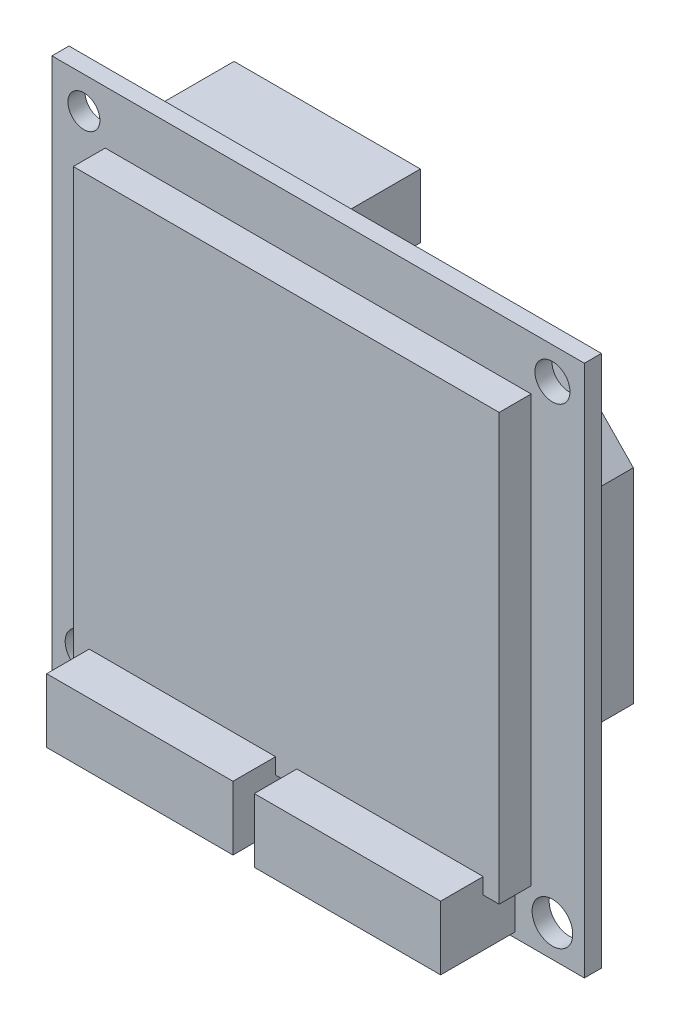
from build123d import *

# Parameters (mm, degrees)
SKETCH1_W      = 50
SKETCH1_H      = 50
SKETCH1_R      = 1.5
SKETCH1_R_2    = 1.646935024
SKETCH1_R_3    = 1.908192471
SKETCH1_R_4    = 1.759080553
EXTRUDE2_DEPTH = 0.8
EXTRUDE3_DEPTH = 3
EXTRUDE4_DEPTH = 8
SKETCH4_W      = 17.5
SKETCH4_H      = 6
EXTRUDE6_DEPTH = 7
SKETCH5_W      = 17.5
SKETCH5_H      = 6
EXTRUDE7_DEPTH = 7


with BuildPart() as part:
    # Sketch1 → Extrude2 (new, symmetric)
    with BuildSketch(Plane.XY):
        Rectangle(SKETCH1_W, SKETCH1_H)
        with Locations((-22, 22)):
            Circle(SKETCH1_R, mode=Mode.SUBTRACT)
        with Locations((22, 22)):
            Circle(SKETCH1_R_2, mode=Mode.SUBTRACT)
        with Locations((22, -22)):
            Circle(SKETCH1_R_3, mode=Mode.SUBTRACT)
        with Locations((-22, -22)):
            Circle(SKETCH1_R_4, mode=Mode.SUBTRACT)
    extrude(amount=EXTRUDE2_DEPTH, both=True)

    # Sketch2 → Extrude3 (add)
    with BuildSketch(Plane.XY.offset(0.8)):
        Polygon((-20, 20), (20, -20), (-20, -20), align=None)
        Polygon((-20, 20), (20, 20), (20, -20), align=None)
    extrude(amount=EXTRUDE3_DEPTH)

    # Sketch3 → Extrude4 (add)
    with BuildSketch(Plane(origin=(0, 0, -0.8), x_dir=(-1, 0, 0), z_dir=(0, 0, -1))):
        Polygon((-20, -10), (-20, 9.2), (-12.4, 17), (-3.6, 17), (4, 9.2), (4, -10), align=None)
    extrude(amount=EXTRUDE4_DEPTH)

    # Sketch4 → Extrude6 (add)
    with BuildSketch(Plane.XY.offset(0.8)):
        with Locations((9.75, -21.5)):
            Rectangle(SKETCH4_W, SKETCH4_H)
        with Locations((-9.75, -21.5)):
            Rectangle(SKETCH4_W, SKETCH4_H)
    extrude(amount=EXTRUDE6_DEPTH)

    # Sketch5 → Extrude7 (add)
    with BuildSketch(Plane(origin=(0, 0, -0.8), x_dir=(-1, 0, 0), z_dir=(0, 0, -1))):
        with Locations((7.75, 21.5)):
            Rectangle(SKETCH5_W, SKETCH5_H)
    extrude(amount=EXTRUDE7_DEPTH)


solid = part.part
